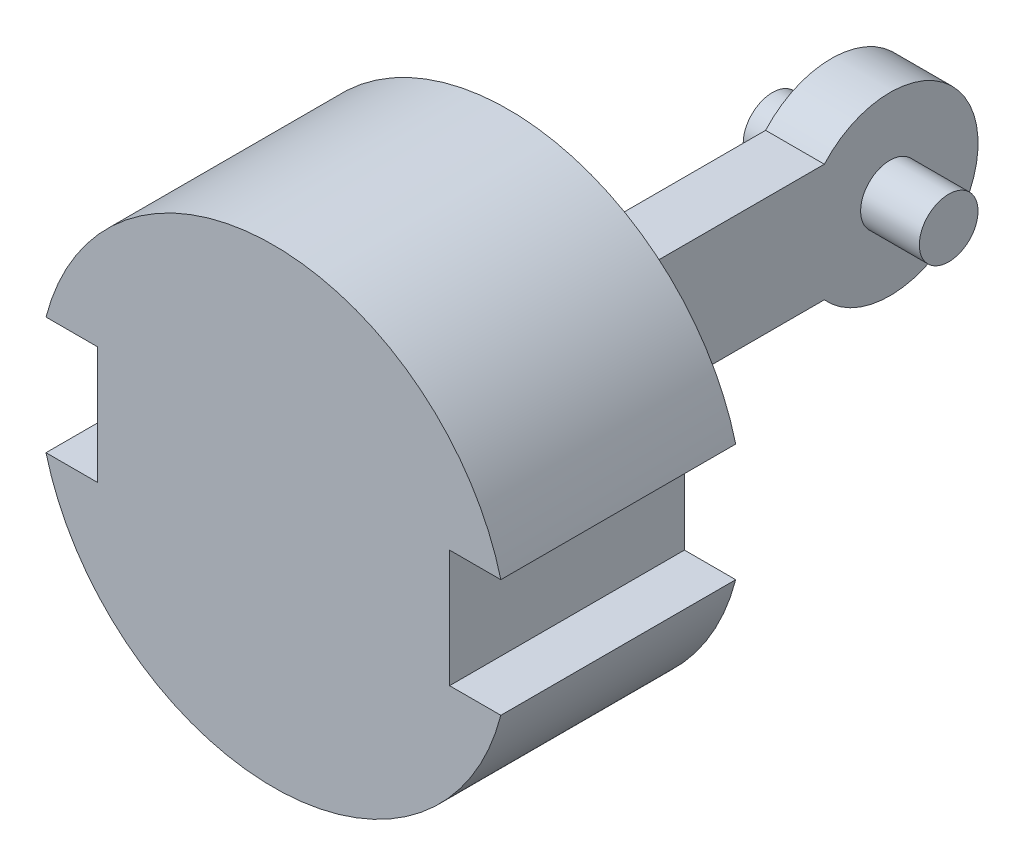
from build123d import *

# Parameters (mm, degrees)
SKETCH1_W           = 12.7
SKETCH1_H           = 25.4
BOSS_EXTRUDE1_DEPTH = 50.8
SKETCH1_3_W         = 12.7
SKETCH1_3_H         = 25.4
BOSS_EXTRUDE2_DEPTH = 127
SKETCH2_R           = 19.05
SKETCH2_R_2         = 6.35
BOSS_EXTRUDE3_DEPTH = 12.7
BOSS_EXTRUDE4_START = -6.35
SKETCH2_2_R         = 6.35
BOSS_EXTRUDE4_DEPTH = 19.05


with BuildPart() as part:
    # Sketch1 → Boss-Extrude1 (new body)
    with BuildSketch(Plane.XY):
        with BuildLine():
            Line((-38.1, -12.7), (-49.186888497, -12.7))
            ThreePointArc((-49.186888497, -12.7), (0, -50.8), (49.186888497, -12.7))
            Line((49.186888497, -12.7), (38.1, -12.7))
            Line((38.1, -12.7), (38.1, 12.7))
            Line((38.1, 12.7), (49.186888497, 12.7))
            ThreePointArc((49.186888497, 12.7), (0, 50.8), (-49.186888497, 12.7))
            Line((-49.186888497, 12.7), (-38.1, 12.7))
            Line((-38.1, 12.7), (-38.1, -12.7))
        make_face()
        Rectangle(SKETCH1_W, SKETCH1_H, mode=Mode.SUBTRACT)
    extrude(amount=-BOSS_EXTRUDE1_DEPTH)

    # Sketch1<3> → Boss-Extrude2 (add)
    with BuildSketch(Plane.XY):
        Rectangle(SKETCH1_3_W, SKETCH1_3_H)
    extrude(amount=-BOSS_EXTRUDE2_DEPTH)

    # Sketch2 → Boss-Extrude3 (add)
    with BuildSketch(Plane(origin=(6.35, 0, 0), x_dir=(0, 0, -1), z_dir=(1, 0, 0))):
        with Locations((127, 0)):
            Circle(SKETCH2_R)
        with Locations((127, 0)):
            Circle(SKETCH2_R_2, mode=Mode.SUBTRACT)
    extrude(amount=-BOSS_EXTRUDE3_DEPTH)

    # Sketch2<2> → Boss-Extrude4 (add, symmetric)
    with BuildSketch(Plane(origin=(6.35, 0, 0), x_dir=(0, 0, -1), z_dir=(1, 0, 0)).offset(BOSS_EXTRUDE4_START)):
        with Locations((127, 0)):
            Circle(SKETCH2_2_R)
    extrude(amount=BOSS_EXTRUDE4_DEPTH, both=True)


solid = part.part
